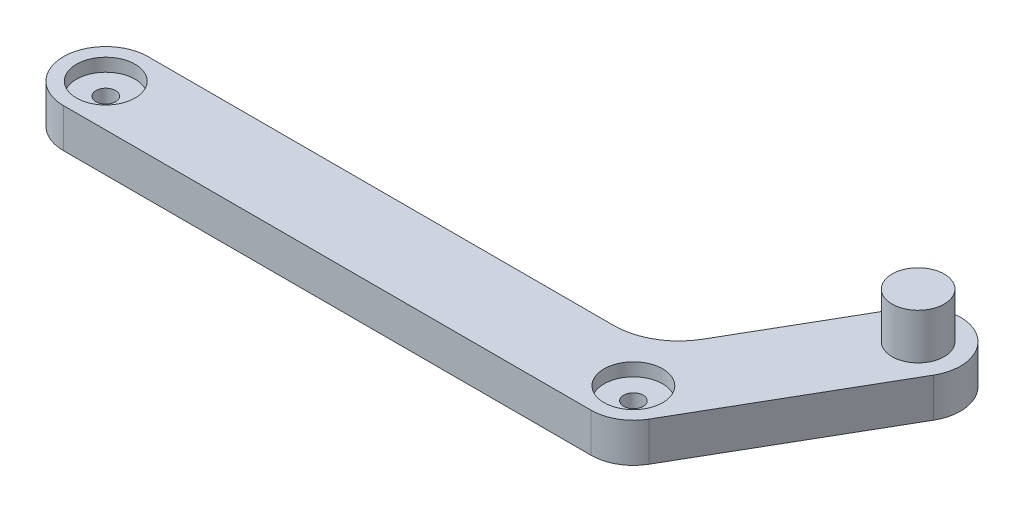
from build123d import *

# Parameters (mm, degrees)
SKETCH1_R           = 1.5
BOSS_EXTRUDE1_DEPTH = 6
SKETCH2_R           = 4.5
CUT_EXTRUDE1_DEPTH  = 2
SKETCH3_R           = 4
BOSS_EXTRUDE2_DEPTH = 7


with BuildPart() as part:
    # Sketch1 → Boss-Extrude1 (new body)
    with BuildSketch(Plane(origin=(0, 0, 0), x_dir=(1, 0, 0), z_dir=(0, 1, 0))):
        with BuildLine():
            Line((0, 6.5), (71.473720558, 6.5))
            ThreePointArc((71.473720558, 6.5), (76.473720558, 7.839745962), (80.133974596, 11.5))
            Line((80.133974596, 11.5), (91.370834875, 30.962812921))
            ThreePointArc((91.370834875, 30.962812921), (100.25, 33.341978046), (102.629165125, 24.462812921))
            Line((102.629165125, 24.462812921), (86.629165125, -3.25))
            ThreePointArc((86.629165125, -3.25), (84.25, -5.629165125), (81, -6.5))
            Line((81, -6.5), (0, -6.5))
            ThreePointArc((0, -6.5), (-6.5, 0), (0, 6.5))
        make_face()
        with Locations(Location((0, 0, 0), (0, 0, 270))):
            Circle(SKETCH1_R, mode=Mode.SUBTRACT)
        with Locations(Location((81, 0, 0), (0, 0, 270))):
            Circle(SKETCH1_R, mode=Mode.SUBTRACT)
    extrude(amount=BOSS_EXTRUDE1_DEPTH)

    # Sketch2 → Cut-Extrude1 (cut)
    with BuildSketch(Plane(origin=(0, 6, 0), x_dir=(1, 0, 0), z_dir=(0, 1, 0))):
        with Locations(Location((0, 0, 0), (0, 0, 270))):
            Circle(SKETCH2_R)
        with Locations(Location((81, 0, 0), (0, 0, 270))):
            Circle(SKETCH2_R)
    extrude(amount=-CUT_EXTRUDE1_DEPTH, mode=Mode.SUBTRACT)

    # Sketch3 → Boss-Extrude2 (add)
    with BuildSketch(Plane(origin=(0, 6, 0), x_dir=(1, 0, 0), z_dir=(0, 1, 0))):
        with Locations(Location((97, 27.712812921, 0), (0, 0, 270))):
            Circle(SKETCH3_R)
    extrude(amount=BOSS_EXTRUDE2_DEPTH)


solid = part.part
